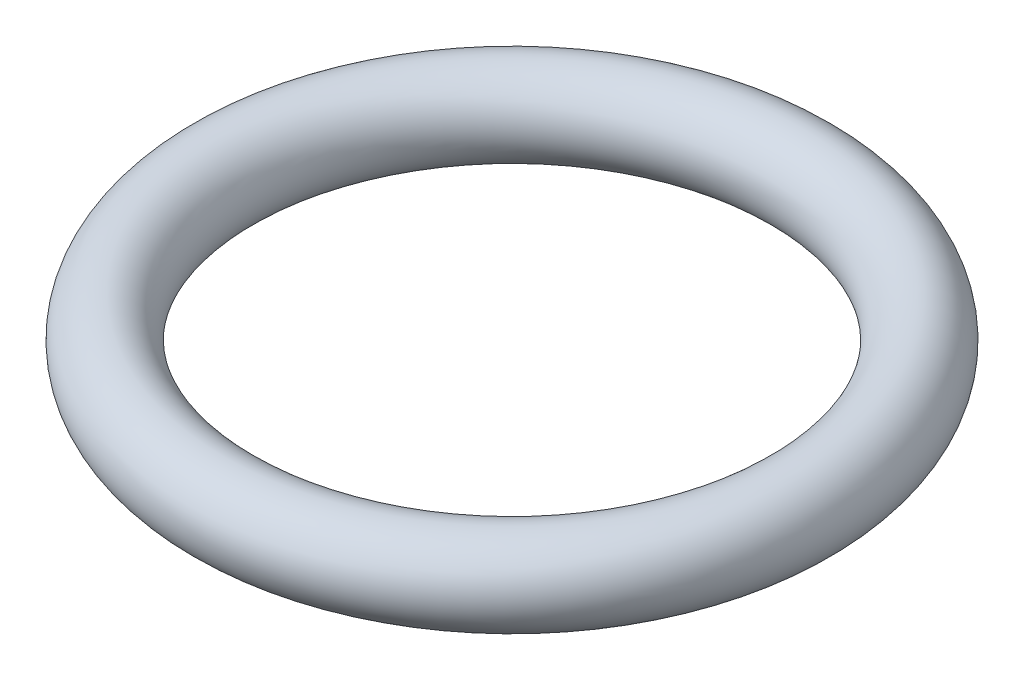
from build123d import *

# Parameters (mm, degrees)
SKETCH2_R = 1.3081


with BuildPart() as part:
    # Sweep1: sweep along a path in Sketch1
    with BuildLine(Plane(origin=(0, 0, 0), x_dir=(1, 0, 0), z_dir=(0, 1, 0))) as sweep1_path:
        CenterArc((0, 0), 7.7724, 0, 360)
    # Sketch2 → Sweep1 (sweep)
    with BuildSketch(Plane.XY):
        with Locations((-9.0805, 0)):
            Circle(SKETCH2_R)
    sweep(path=sweep1_path.line)


solid = part.part
